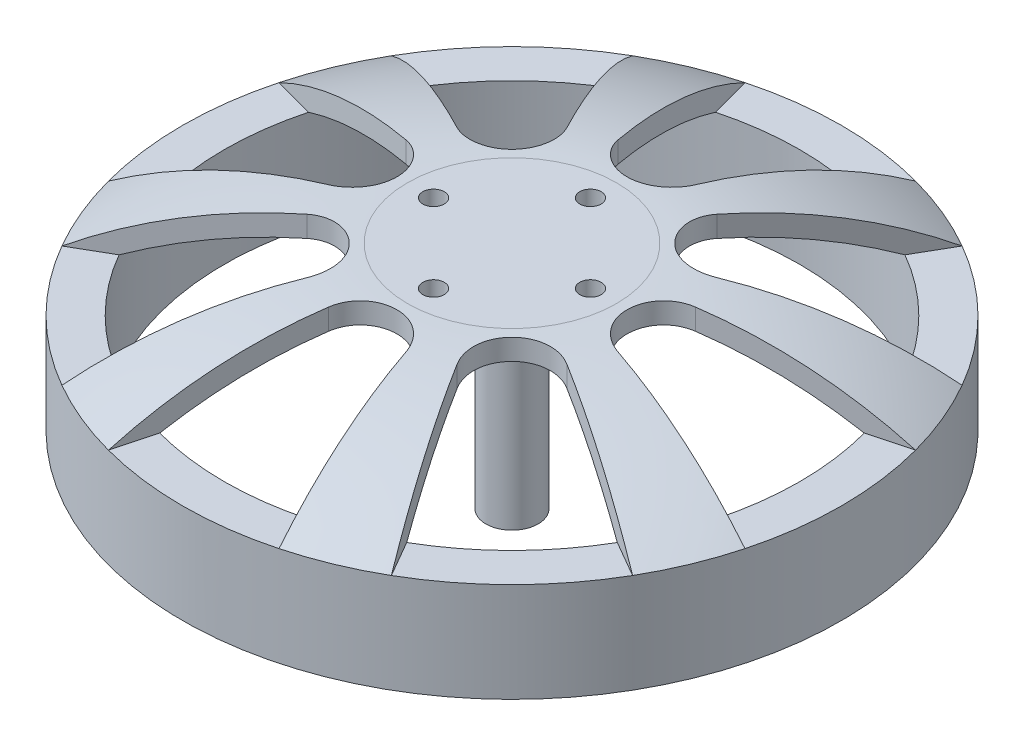
from build123d import *

# Parameters (mm, degrees)
CUT_EXTRUDE1_START       = -6
CUT_EXTRUDE1_DEPTH       = 6
CIRPATTERN1_COUNT        = 8
M2_5X0_45_TAPPED_HOLE1_D = 2.05


with BuildPart() as part:
    # Sketch2 → Revolve1 (revolve)
    with BuildSketch(Plane.XY, mode=Mode.PRIVATE) as revolve1_sk:
        with BuildLine():
            Line((0, 0), (0, 22))
            Line((0, 22), (-10, 22))
            ThreePointArc((-10, 22), (-21.160757143, 20.471879762), (-31.5, 16))
            Line((-31.5, 16), (-31.5, 6.5))
            Line((-31.5, 6.5), (-27.5, 6.5))
            Line((-27.5, 6.5), (-27.5, 16))
            ThreePointArc((-27.5, 16), (-18.975661536, 18.987269218), (-10, 20))
            Line((-10, 20), (-2.5, 20))
            Line((-2.5, 20), (-2.5, 0))
            Line((-2.5, 0), (0, 0))
        make_face()
    revolve(revolve1_sk.sketch.rotate(Axis((0, 0, 0), (0, 1, 0)), 270), axis=Axis((0, 0, 0), (0, 1, 0)))

    # Sketch3 → Cut-Extrude1 (cut)
    with BuildSketch(Plane(origin=(0, 22, 0), x_dir=(1, 0, 0), z_dir=(0, 1, 0)).offset(CUT_EXTRUDE1_START)):
        with BuildLine():
            Line((-8.152799921, 30.426663528), (-3.710295012, 13.847009496))
            ThreePointArc((-3.710295012, 13.847009496), (0, 11), (3.710295012, 13.847009496))
            Line((3.710295012, 13.847009496), (8.152799921, 30.426663528))
            ThreePointArc((8.152799921, 30.426663528), (0, 31.5), (-8.152799921, 30.426663528))
        make_face()
    cut_extrude1 = extrude(amount=CUT_EXTRUDE1_DEPTH, mode=Mode.SUBTRACT)

    # CirPattern1: Cut-Extrude1 ×8 about axis
    cirpattern1_axis = Axis((0, 0, 0), (0, 1, 0))
    for i in range(1, CIRPATTERN1_COUNT):
        add(cut_extrude1.rotate(cirpattern1_axis, i * 360 / CIRPATTERN1_COUNT), mode=Mode.SUBTRACT)

    # M2.5x0.45 Tapped Hole1 (through all)
    with Locations(Plane(origin=(0, 22, 0), x_dir=(1, 0, 0), z_dir=(0, 1, 0))):
        with Locations((0, 7.5), (7.5, 0), (0, -7.5), (-7.5, 0)):
            Hole(M2_5X0_45_TAPPED_HOLE1_D / 2)


solid = part.part
